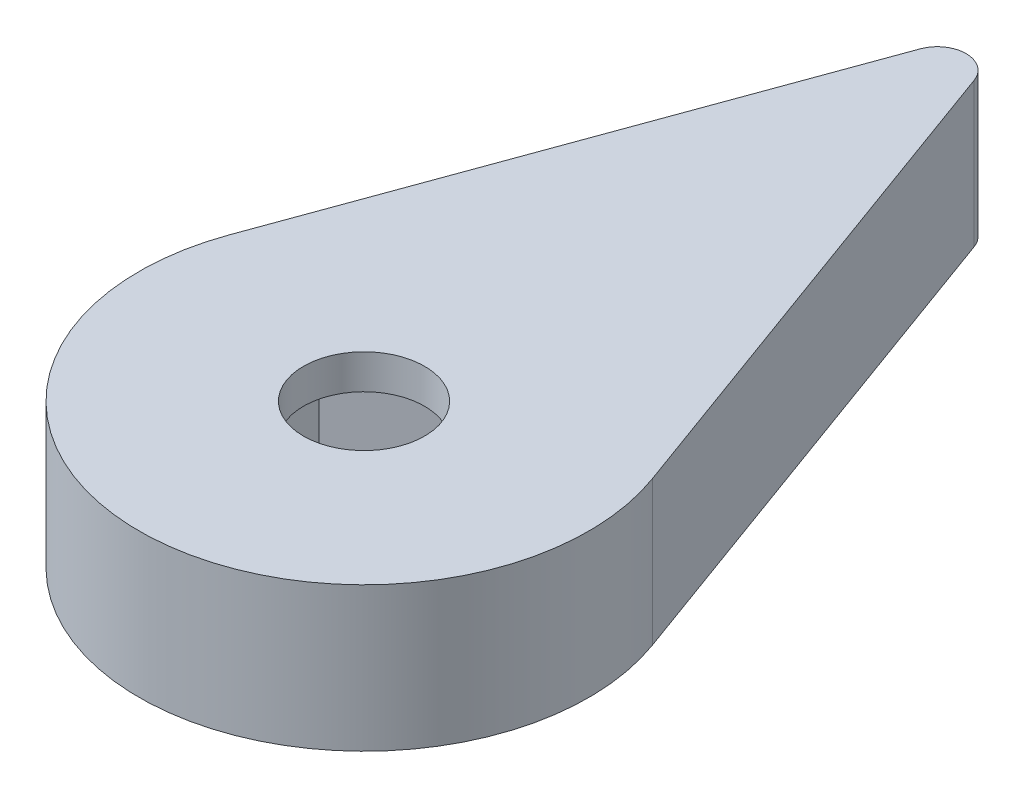
from build123d import *

# Parameters (mm, degrees)
BOSS_EXTRUDE2_DEPTH = 5
CUT_EXTRUDE1_REACH  = 24.845
SKETCH3_R           = 2.1
CUT_EXTRUDE2_START  = -1.2
CUT_EXTRUDE2_DEPTH  = 3.6


with BuildPart() as part:
    # Sketch1 → Boss-Extrude2 (new body)
    with BuildSketch(Plane(origin=(0, 0, 0), x_dir=(1, 0, 0), z_dir=(0, 1, 0))):
        with BuildLine():
            Line((-0.939692556, 20.223890242), (-7.329602442, 2.667757118))
            ThreePointArc((-7.329602442, 2.667757118), (0, -7.8), (7.329602442, 2.667757118))
            Line((7.329602442, 2.667757118), (0.939692556, 20.223890242))
            ThreePointArc((0.939692556, 20.223890242), (0, 20.881870053), (-0.939692556, 20.223890242))
        make_face()
    extrude(amount=BOSS_EXTRUDE2_DEPTH)

    # Sketch3 → Cut-Extrude1 (cut, up to next)
    with BuildSketch(Plane(origin=(0, 5, 0), x_dir=(1, 0, 0), z_dir=(0, 1, 0)), mode=Mode.PRIVATE) as cut_extrude1_sk1:
        with Locations(Location((0, 0, 0), (0, 0, 270))):
            Circle(SKETCH3_R)
    cut_extrude1_tool1 = extrude(cut_extrude1_sk1.sketch, amount=-CUT_EXTRUDE1_REACH, mode=Mode.PRIVATE) & part.part
    add(cut_extrude1_tool1.solids().sort_by_distance((0, 5, 0))[0], mode=Mode.SUBTRACT)

    # Sketch4 → Cut-Extrude2 (cut)
    with BuildSketch(Plane(origin=(0, 5, 0), x_dir=(1, 0, 0), z_dir=(0, 1, 0)).offset(CUT_EXTRUDE2_START)):
        Polygon((0, 4.272391992), (-3.7, 2.136195996), (-3.7, -2.136195996), (0, -4.272391992), (3.7, -2.136195996), (3.7, 2.136195996), align=None)
    extrude(amount=-CUT_EXTRUDE2_DEPTH, mode=Mode.SUBTRACT)


solid = part.part
